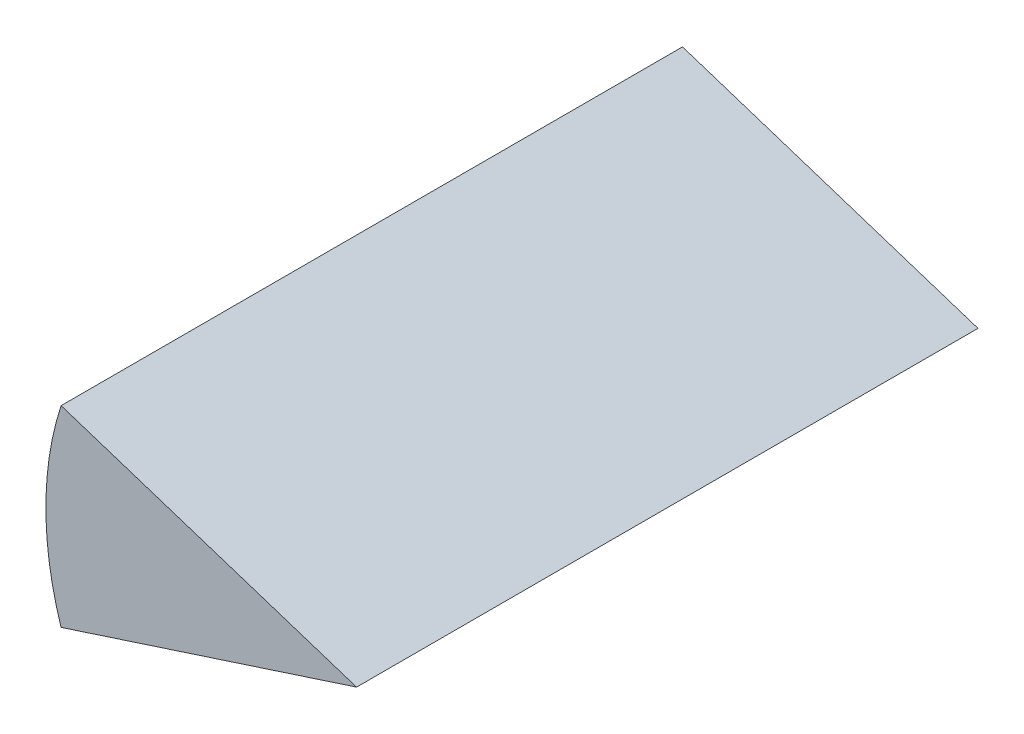
from build123d import *

# Parameters (mm, degrees)
SALIENTE_EXTRUIR1_DEPTH = 50
CROQUIS2_R              = 5
CORTAR_EXTRUIR1_DEPTH   = 10


with BuildPart() as part:
    # Croquis1 → Saliente-Extruir1 (new body)
    with BuildSketch(Plane.XY):
        with BuildLine():
            Line((0, 0), (-23.776412907, 7.725424859))
            ThreePointArc((-23.776412907, 7.725424859), (-25, 0), (-23.776412907, -7.725424859))
            Line((-23.776412907, -7.725424859), (0, 0))
        make_face()
    extrude(amount=SALIENTE_EXTRUIR1_DEPTH)

    # Croquis2 → Cortar-Extruir1 (cut)
    with BuildSketch(Plane(origin=(0, 0, 0), x_dir=(-1, 0, 0), z_dir=(0, 0, -1))):
        with Locations((18.966905847, 0.102882593)):
            Circle(CROQUIS2_R)
    extrude(amount=-CORTAR_EXTRUIR1_DEPTH, mode=Mode.SUBTRACT)


solid = part.part
